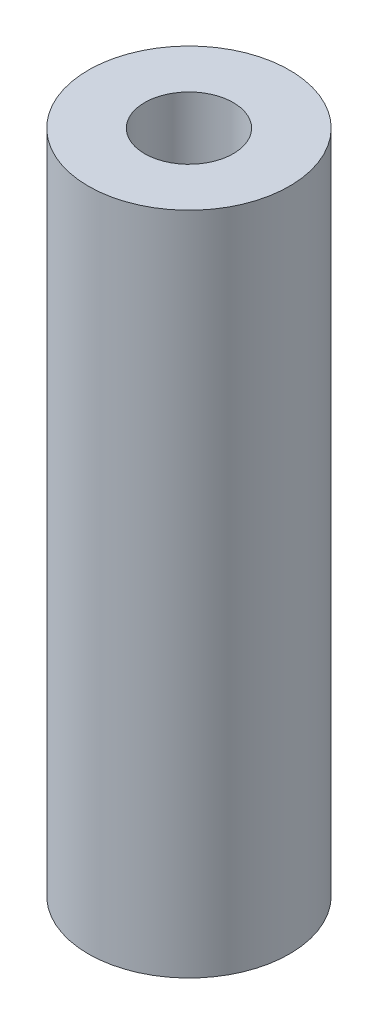
from build123d import *

# Parameters (mm, degrees)
SKETCH1_R           = 5.9
BOSS_EXTRUDE1_DEPTH = 39
SKETCH2_R           = 2.6
CUT_EXTRUDE1_DEPTH  = 4


with BuildPart() as part:
    # Sketch1 → Boss-Extrude1 (new body)
    with BuildSketch(Plane(origin=(0, 0, 0), x_dir=(1, 0, 0), z_dir=(0, 1, 0))):
        with Locations(Location((0, 0, 0), (0, 0, 270))):
            Circle(SKETCH1_R)
    extrude(amount=BOSS_EXTRUDE1_DEPTH)

    # Sketch2 → Cut-Extrude1 (cut)
    with BuildSketch(Plane(origin=(0, 39, 0), x_dir=(1, 0, 0), z_dir=(0, 1, 0))):
        with Locations(Location((0, 0, 0), (0, 0, 270))):
            Circle(SKETCH2_R)
    extrude(amount=-CUT_EXTRUDE1_DEPTH, mode=Mode.SUBTRACT)


solid = part.part
